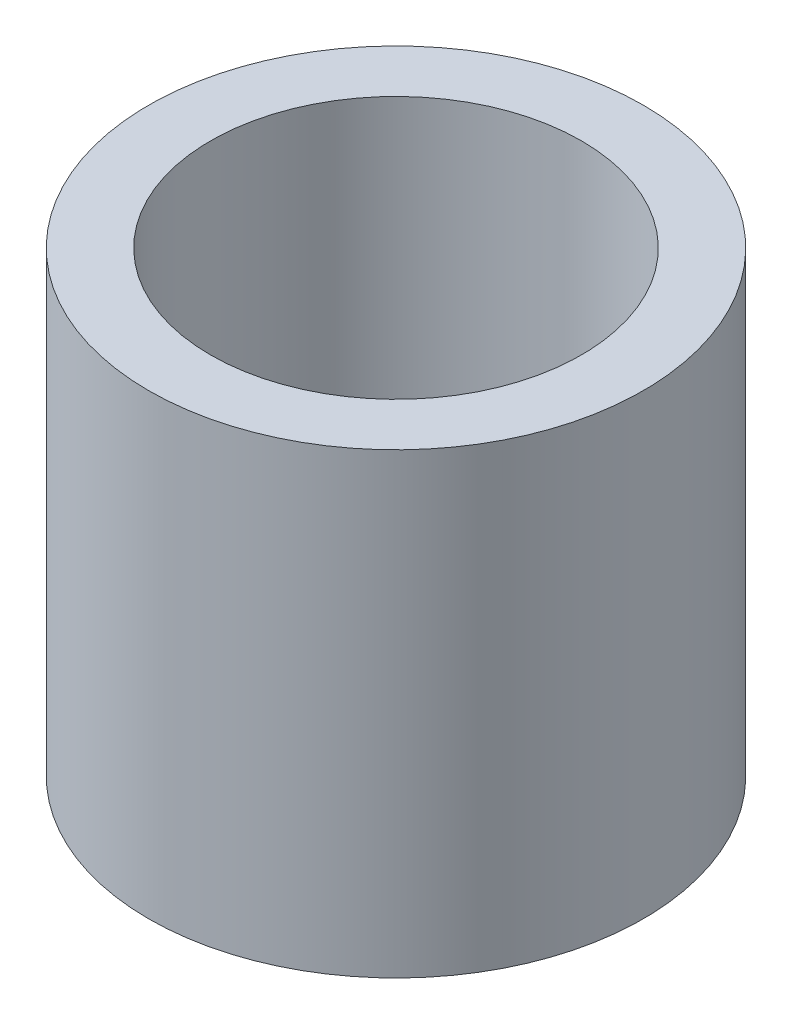
from build123d import *

# Parameters (mm, degrees)
SKETCH1_R           = 4
SKETCH1_R_2         = 3
BOSS_EXTRUDE1_DEPTH = 7.399


with BuildPart() as part:
    # Sketch1 → Boss-Extrude1 (new body)
    with BuildSketch(Plane(origin=(0, 0, 0), x_dir=(1, 0, 0), z_dir=(0, 1, 0))):
        with Locations(Location((0, 0, 0), (0, 0, 90))):
            Circle(SKETCH1_R)
        with Locations(Location((0, 0, 0), (0, 0, 90))):
            Circle(SKETCH1_R_2, mode=Mode.SUBTRACT)
    extrude(amount=BOSS_EXTRUDE1_DEPTH)


solid = part.part
